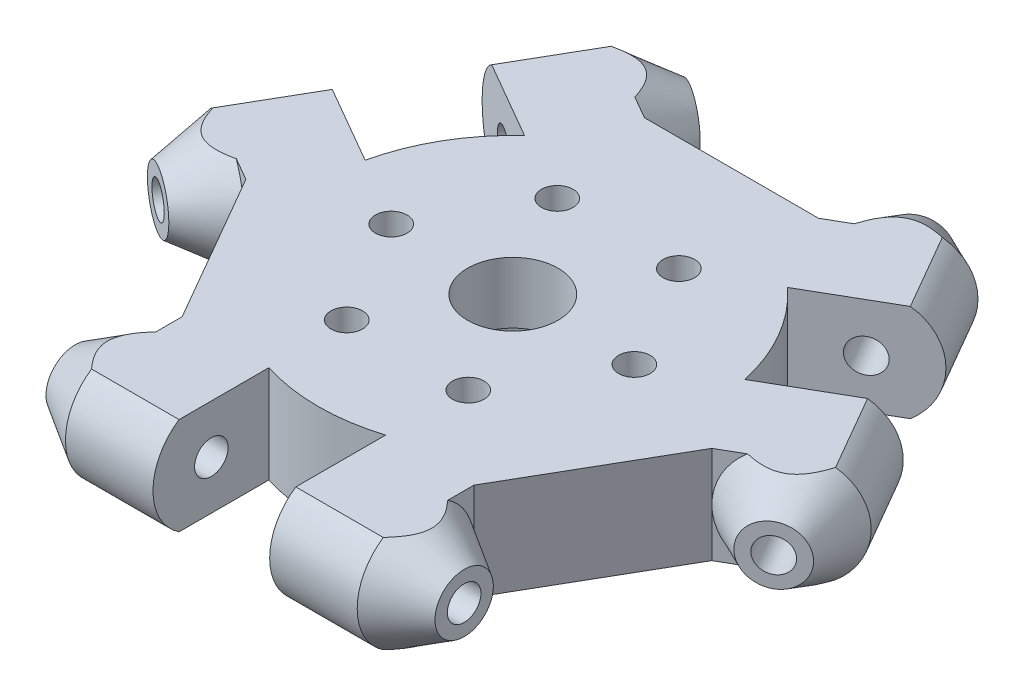
from build123d import *

# Parameters (mm, degrees)
BOSS_EXTRUDE1_DEPTH      = 5
BOSS_EXTRUDE1_DEPTH_BACK = 5
CIRPATTERN1_COUNT        = 3
SKETCH7_R                = 1.725
CUT_EXTRUDE2_DEPTH       = 47.868710659
CIRPATTERN2_COUNT        = 3
CUT_EXTRUDE3_DEPTH       = 47.751214304
CUT_EXTRUDE3_DEPTH_BACK  = 47.751214304
SKETCH8_R                = 8.5
SKETCH8_R_2              = 1.625
SKETCH9_R                = 8.5
SKETCH9_R_2              = 4.65
BOSS_EXTRUDE2_DEPTH      = 6.3


with BuildPart() as part:
    # Sketch4 → Boss-Extrude1 (new, two sides: drawn at the far end of the back side and taken through both)
    with BuildSketch(Plane(origin=(0, 0, 0), x_dir=(1, 0, 0), z_dir=(0, 1, 0)).offset(-BOSS_EXTRUDE1_DEPTH_BACK)):
        with BuildLine():
            Line((23.846787517, 20.696152423), (13.522711642, 14.735544437))
            ThreePointArc((13.522711642, 14.735544437), (17.320508076, 10), (19.522711642, 4.343239591))
            Line((19.522711642, 4.343239591), (29.846787517, 10.303847577))
            Line((29.846787517, 10.303847577), (34.346787517, 2.509618943))
            Line((34.346787517, 2.509618943), (23.954482672, -3.490381057))
            Line((23.954482672, -3.490381057), (15, -19))
            Line((15, -19), (15, -31))
            Line((15, -31), (6, -31))
            Line((6, -31), (6, -19.078784028))
            ThreePointArc((6, -19.078784028), (0, -20), (-6, -19.078784028))
            Line((-6, -19.078784028), (-6, -31))
            Line((-6, -31), (-15, -31))
            Line((-15, -31), (-15, -19))
            Line((-15, -19), (-23.954482672, -3.490381057))
            Line((-23.954482672, -3.490381057), (-34.346787517, 2.509618943))
            Line((-34.346787517, 2.509618943), (-29.846787517, 10.303847577))
            Line((-29.846787517, 10.303847577), (-19.522711642, 4.343239591))
            ThreePointArc((-19.522711642, 4.343239591), (-17.320508076, 10), (-13.522711642, 14.735544437))
            Line((-13.522711642, 14.735544437), (-23.846787517, 20.696152423))
            Line((-23.846787517, 20.696152423), (-19.346787517, 28.490381057))
            Line((-19.346787517, 28.490381057), (-8.954482672, 22.490381057))
            Line((-8.954482672, 22.490381057), (8.954482672, 22.490381057))
            Line((8.954482672, 22.490381057), (19.346787517, 28.490381057))
            Line((19.346787517, 28.490381057), (23.846787517, 20.696152423))
        make_face()
    extrude(amount=BOSS_EXTRUDE1_DEPTH + BOSS_EXTRUDE1_DEPTH_BACK)

    # Sketch6 → Revolve1 (revolve)
    with BuildSketch(Plane(origin=(0, 0, 0), x_dir=(1, 0, 0), z_dir=(0, 1, 0))):
        Polygon((-15, -25), (-20, -25), (-20, -28), (-15, -31), align=None)
        Polygon((15, -31), (15, -25), (20, -25), (20, -28), align=None)
    revolve1 = revolve(axis=Axis((-15, 0, 25), (1, 0, 0)))

    # CirPattern1: Revolve1 ×3 about axis
    cirpattern1_axis = Axis((0, 5, 0), (0, 1, 0))
    for i in range(1, CIRPATTERN1_COUNT):
        add(revolve1.rotate(cirpattern1_axis, i * 360 / CIRPATTERN1_COUNT))

    # Sketch7 → Cut-Extrude2 (cut, symmetric)
    with BuildSketch(Plane(origin=(0, 0, 0), x_dir=(0, 0, -1), z_dir=(1, 0, 0))):
        with Locations((-25, 0)):
            Circle(SKETCH7_R)
        with BuildLine():
            Line((-28.31662479, 5), (-19, 5))
            Line((-19, 5), (-19, 25))
            Line((-19, 25), (-39, 25))
            Line((-39, 25), (-39, -25))
            Line((-39, -25), (-19, -25))
            Line((-19, -25), (-19, -5))
            Line((-19, -5), (-28.31662479, -5))
            ThreePointArc((-28.31662479, -5), (-31, 0), (-28.31662479, 5))
        make_face()
    cut_extrude2 = extrude(amount=CUT_EXTRUDE2_DEPTH, both=True, mode=Mode.SUBTRACT)

    # CirPattern2: Cut-Extrude2 ×3 about axis
    cirpattern2_axis = Axis((0, 5, 0), (0, 1, 0))
    for i in range(1, CIRPATTERN2_COUNT):
        add(cut_extrude2.rotate(cirpattern2_axis, i * 360 / CIRPATTERN2_COUNT), mode=Mode.SUBTRACT)

    # Sketch8 → Cut-Extrude3 (cut, two sides: drawn at the far end of the back side and taken through both)
    with BuildSketch(Plane(origin=(0, 0, 0), x_dir=(1, 0, 0), z_dir=(0, 1, 0)).offset(-CUT_EXTRUDE3_DEPTH_BACK)):
        Circle(SKETCH8_R)
        with Locations((-12.5, 0)):
            Circle(SKETCH8_R_2)
        with Locations((-6.25, 10.825317547)):
            Circle(SKETCH8_R_2)
        with Locations((6.25, 10.825317547)):
            Circle(SKETCH8_R_2)
        with Locations((12.5, 0)):
            Circle(SKETCH8_R_2)
        with Locations((6.25, -10.825317547)):
            Circle(SKETCH8_R_2)
        with Locations((-6.25, -10.825317547)):
            Circle(SKETCH8_R_2)
    extrude(amount=CUT_EXTRUDE3_DEPTH + CUT_EXTRUDE3_DEPTH_BACK, mode=Mode.SUBTRACT)

    # Sketch9 → Boss-Extrude2 (add)
    with BuildSketch(Plane(origin=(0, 5, 0), x_dir=(1, 0, 0), z_dir=(0, 1, 0))):
        Circle(SKETCH9_R)
        Circle(SKETCH9_R_2, mode=Mode.SUBTRACT)
    extrude(amount=-BOSS_EXTRUDE2_DEPTH)


solid = part.part
